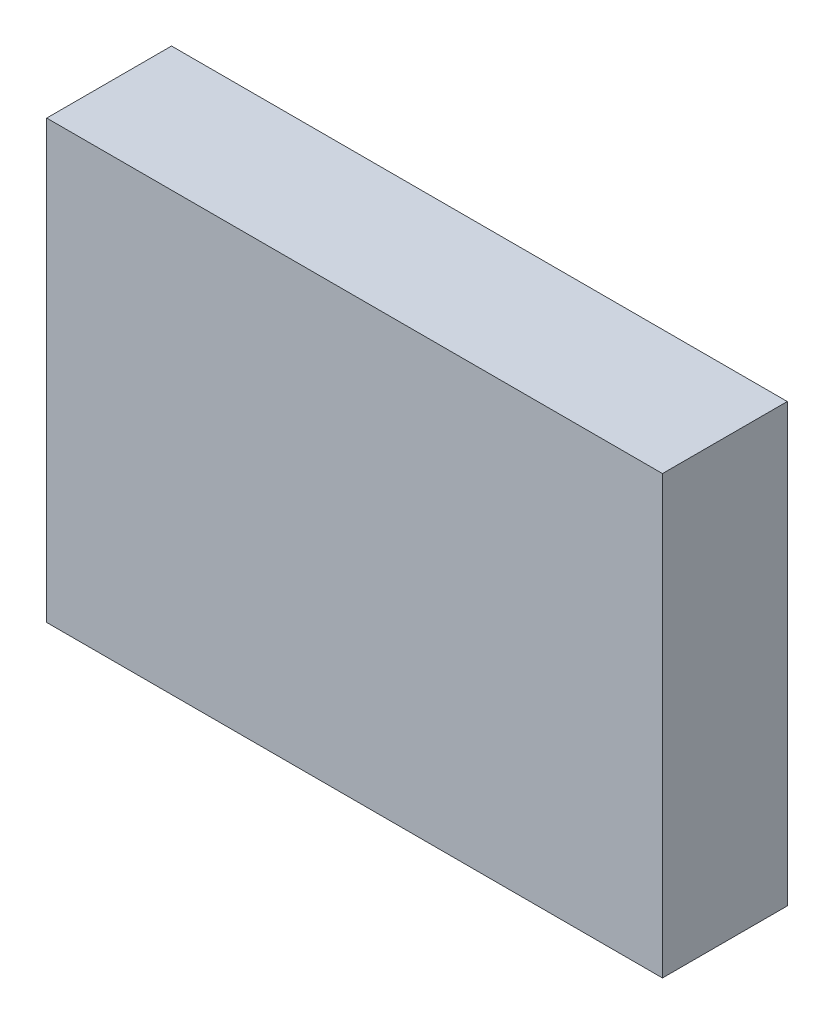
from build123d import *

# Parameters (mm, degrees)
SKETCH_1_W      = 148
SKETCH_1_H      = 105
EXTRUDE_1_DEPTH = 30


with BuildPart() as part:
    # ｽｹｯﾁ1 → ﾎﾞｽ - 押し出し1 (new body)
    with BuildSketch(Plane.XY):
        Rectangle(SKETCH_1_W, SKETCH_1_H)
    extrude(amount=EXTRUDE_1_DEPTH)


solid = part.part
